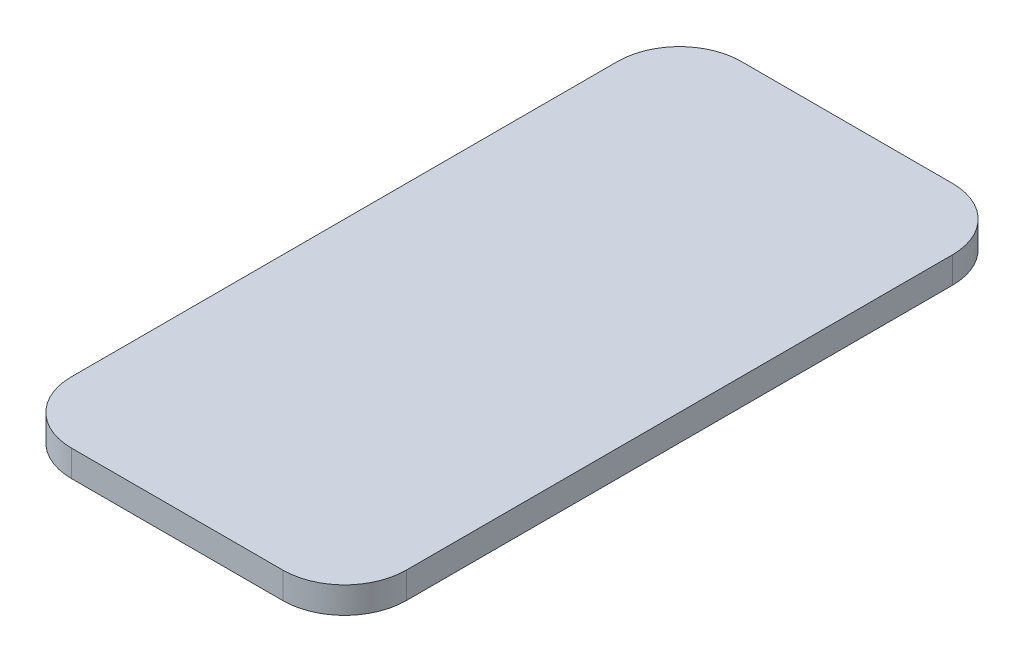
from build123d import *

# Parameters (mm, degrees)
BOSS_EXTRUDE1_DEPTH = 3


with BuildPart() as part:
    # Sketch1 → Boss-Extrude1 (new body)
    with BuildSketch(Plane(origin=(0, 0, 0), x_dir=(1, 0, 0), z_dir=(0, 1, 0))):
        with BuildLine():
            Line((-12, -38), (12, -38))
            ThreePointArc((12, -38), (16.949747468, -35.949747468), (19, -31))
            Line((19, -31), (19, 31))
            ThreePointArc((19, 31), (16.949747468, 35.949747468), (12, 38))
            Line((12, 38), (-12, 38))
            ThreePointArc((-12, 38), (-16.949747468, 35.949747468), (-19, 31))
            Line((-19, 31), (-19, -31))
            ThreePointArc((-19, -31), (-16.949747468, -35.949747468), (-12, -38))
        make_face()
    extrude(amount=BOSS_EXTRUDE1_DEPTH)


solid = part.part
